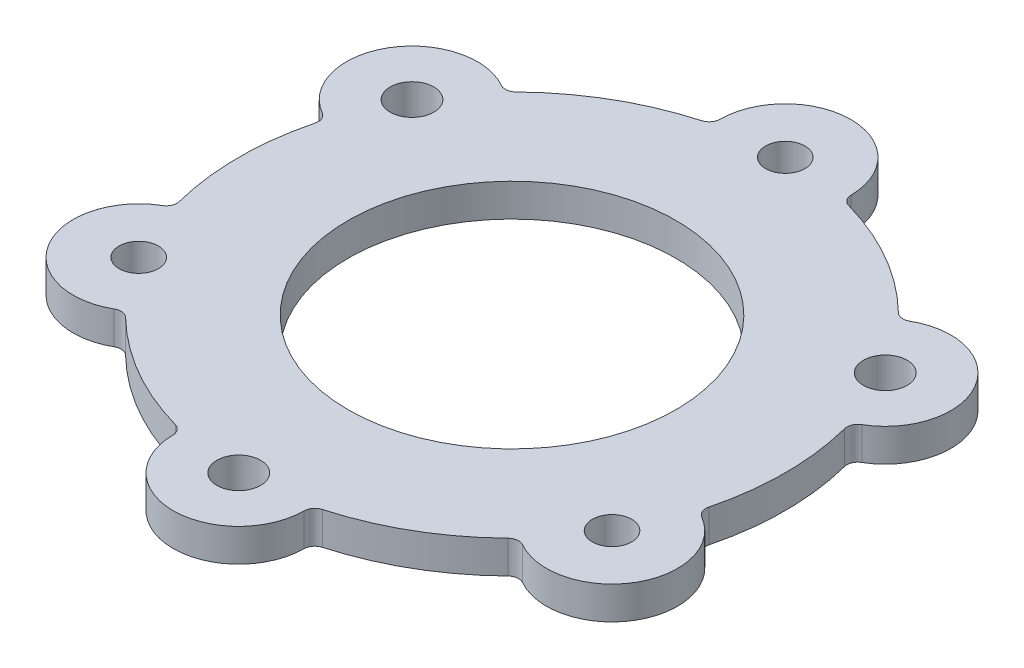
from build123d import *

# Parameters (mm, degrees)
SKETCH1_R           = 0.9
SKETCH1_R_2         = 7.5
SKETCH1_R_3         = 1
BOSS_EXTRUDE1_DEPTH = 1.5
FILLET1_R           = 0.5


with BuildPart() as part:
    # Sketch1 → Boss-Extrude1 (new body)
    with BuildSketch(Plane(origin=(0, 0, 0), x_dir=(1, 0, 0), z_dir=(0, 1, 0))):
        with BuildLine():
            Line((-3, -12.1346611), (-3, -12.5))
            ThreePointArc((-3, -12.5), (0, -15.5), (3, -12.5))
            Line((3, -12.5), (3, -12.1346611))
            ThreePointArc((3, -12.1346611), (6.25, -10.825317547), (9.008924778, -8.665406761))
            Line((9.008924778, -8.665406761), (9.325317547, -8.848076211))
            ThreePointArc((9.325317547, -8.848076211), (13.423393759, -7.75), (12.325317547, -3.651923789))
            Line((12.325317547, -3.651923789), (12.008924778, -3.469254338))
            ThreePointArc((12.008924778, -3.469254338), (12.5, 0), (12.008924778, 3.469254338))
            Line((12.008924778, 3.469254338), (12.325317547, 3.651923789))
            ThreePointArc((12.325317547, 3.651923789), (13.423393759, 7.75), (9.325317547, 8.848076211))
            Line((9.325317547, 8.848076211), (9.008924778, 8.665406761))
            ThreePointArc((9.008924778, 8.665406761), (6.25, 10.825317547), (3, 12.1346611))
            Line((3, 12.1346611), (3, 12.5))
            ThreePointArc((3, 12.5), (0, 15.5), (-3, 12.5))
            Line((-3, 12.5), (-3, 12.1346611))
            ThreePointArc((-3, 12.1346611), (-6.25, 10.825317547), (-9.008924778, 8.665406761))
            Line((-9.008924778, 8.665406761), (-9.325317547, 8.848076211))
            ThreePointArc((-9.325317547, 8.848076211), (-13.423393759, 7.75), (-12.325317547, 3.651923789))
            Line((-12.325317547, 3.651923789), (-12.008924778, 3.469254338))
            ThreePointArc((-12.008924778, 3.469254338), (-12.5, 0), (-12.008924778, -3.469254338))
            Line((-12.008924778, -3.469254338), (-12.325317547, -3.651923789))
            ThreePointArc((-12.325317547, -3.651923789), (-13.423393759, -7.75), (-9.325317547, -8.848076211))
            Line((-9.325317547, -8.848076211), (-9.008924778, -8.665406761))
            ThreePointArc((-9.008924778, -8.665406761), (-6.25, -10.825317547), (-3, -12.1346611))
        make_face()
        with Locations(Location((-10.825317547, -6.25, 0), (0, 0, 270))):
            Circle(SKETCH1_R, mode=Mode.SUBTRACT)
        with Locations(Location((0, 0, 0), (0, 0, 270))):
            Circle(SKETCH1_R_2, mode=Mode.SUBTRACT)
        with Locations(Location((-10.825317547, 6.25, 0), (0, 0, 270))):
            Circle(SKETCH1_R_3, mode=Mode.SUBTRACT)
        with Locations(Location((0, 12.5, 0), (0, 0, 270))):
            Circle(SKETCH1_R, mode=Mode.SUBTRACT)
        with Locations(Location((10.825317547, 6.25, 0), (0, 0, 270))):
            Circle(SKETCH1_R_3, mode=Mode.SUBTRACT)
        with Locations(Location((10.825317547, -6.25, 0), (0, 0, 270))):
            Circle(SKETCH1_R, mode=Mode.SUBTRACT)
        with Locations(Location((0, -12.5, 0), (0, 0, 270))):
            Circle(SKETCH1_R_3, mode=Mode.SUBTRACT)
    extrude(amount=BOSS_EXTRUDE1_DEPTH)

    # Fillet1
    fillet1_edges = [part.edges().sort_by_distance(p)[0] for p in [
        (-3, 0.75, 12.1346611),
        (3, 0.75, 12.1346611),
        (9.008924778, 0.75, 8.665406761),
        (12.008924778, 0.75, 3.469254338),
        (12.008924778, 0.75, -3.469254338),
        (9.008924778, 0.75, -8.665406761),
        (3, 0.75, -12.1346611),
        (-3, 0.75, -12.1346611),
        (-9.008924778, 0.75, -8.665406761),
        (-12.008924778, 0.75, -3.469254338),
        (-12.008924778, 0.75, 3.469254338),
        (-9.008924778, 0.75, 8.665406761),
    ]]
    fillet(fillet1_edges, radius=FILLET1_R)


solid = part.part
